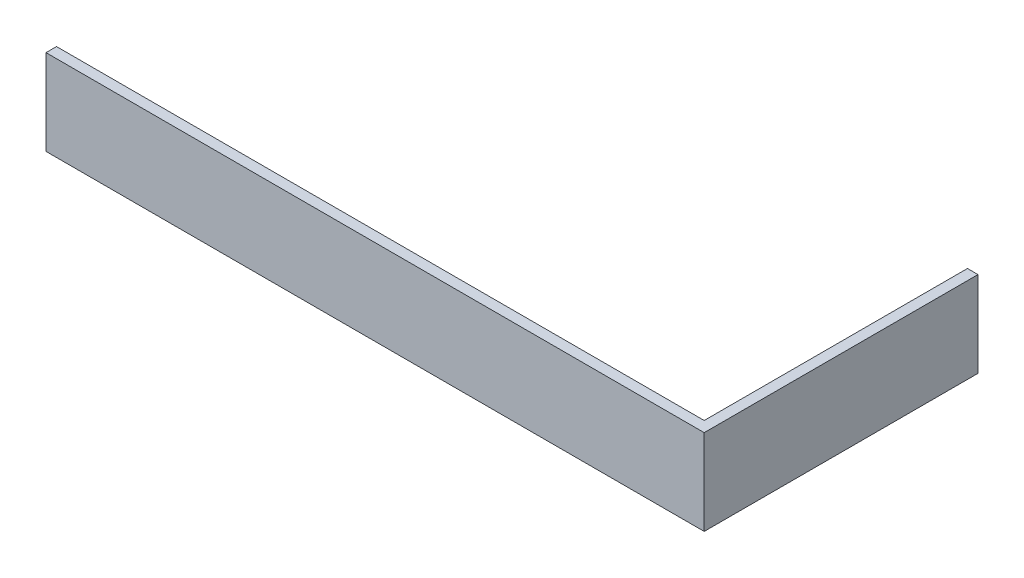
from build123d import *

# Parameters (mm, degrees)
SKETCH1_W           = 100
SKETCH1_H           = 13
BOSS_EXTRUDE1_DEPTH = 1.6
SKETCH3_W           = 1.6
SKETCH3_H           = 13
BOSS_EXTRUDE2_DEPTH = 40


with BuildPart() as part:
    # Sketch1 → Boss-Extrude1 (new body)
    with BuildSketch(Plane.XY):
        Rectangle(SKETCH1_W, SKETCH1_H)
    extrude(amount=BOSS_EXTRUDE1_DEPTH)

    # Sketch3 → Boss-Extrude2 (add)
    with BuildSketch(Plane(origin=(0, 0, 0), x_dir=(-1, 0, 0), z_dir=(0, 0, -1))):
        with Locations((-49.2, 0)):
            Rectangle(SKETCH3_W, SKETCH3_H)
    extrude(amount=BOSS_EXTRUDE2_DEPTH)


solid = part.part
